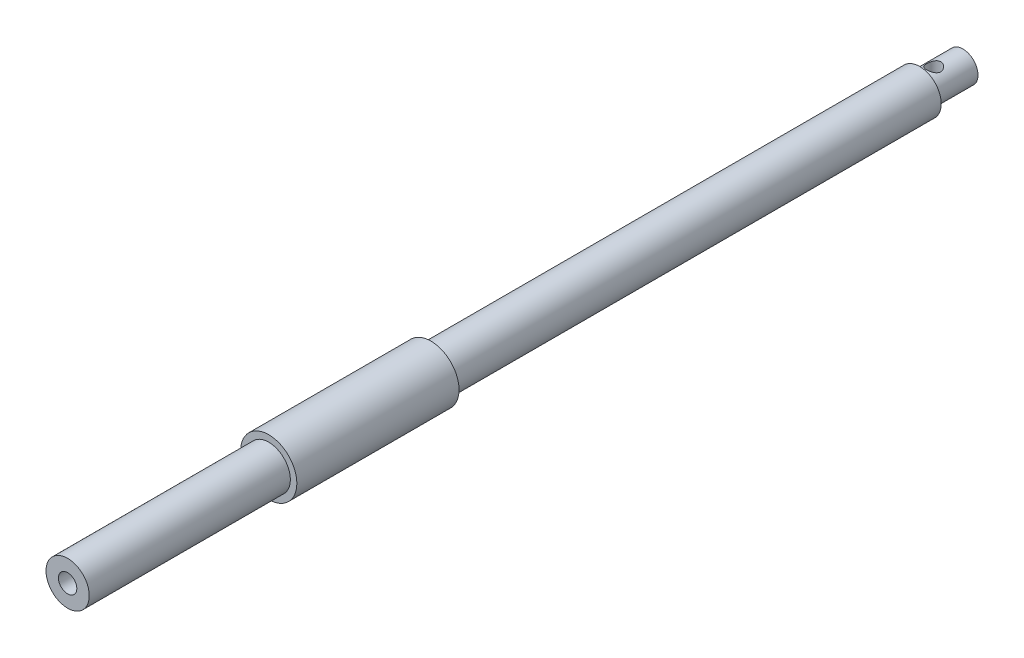
from build123d import *

# Parameters (mm, degrees)
SCHIZZO1_R                    = 7
ESTRUSIONE1_DEPTH             = 20
SCHIZZO2_R                    = 10
ESTRUSIONE2_DEPTH             = 226
SCHIZZO6_R                    = 13
ESTRUSIONE_ESTRUSIONE1_DEPTH  = 75
SCHIZZO7_R                    = 10
ESTRUSIONE_ESTRUSIONE2_DEPTH  = 93
FORO_FILETTATO_M10_1_D        = 8.5
FORO_FILETTATO_M10_1_DEPTH    = 27.5
FORO_FILETTATO_M10_1_TIP      = 2.553657631
TAGLIO_ESTRUSIONE1_DEPTH      = 10
TAGLIO_ESTRUSIONE1_DEPTH_BACK = 10
SCHIZZO10_R                   = 3.25


with BuildPart() as part:
    # Schizzo1 → Estrusione1 (new body)
    with BuildSketch(Plane.XY):
        Circle(SCHIZZO1_R)
    extrude(amount=ESTRUSIONE1_DEPTH)

    # Schizzo2 → Estrusione2 (add)
    with BuildSketch(Plane.XY.offset(20)):
        Circle(SCHIZZO2_R)
    extrude(amount=ESTRUSIONE2_DEPTH)

    # Schizzo6 → Estrusione-Estrusione1 (add)
    with BuildSketch(Plane.XY.offset(246)):
        Circle(SCHIZZO6_R)
    extrude(amount=ESTRUSIONE_ESTRUSIONE1_DEPTH)

    # Schizzo7 → Estrusione-Estrusione2 (add)
    with BuildSketch(Plane.XY.offset(321)):
        Circle(SCHIZZO7_R)
    extrude(amount=ESTRUSIONE_ESTRUSIONE2_DEPTH)

    # Foro filettato M10-1
    with Locations(Plane.XY.offset(414)):
        with Locations((0, 0)):
            Hole(FORO_FILETTATO_M10_1_D / 2, depth=FORO_FILETTATO_M10_1_DEPTH)
            with Locations((0, 0, -(FORO_FILETTATO_M10_1_DEPTH + FORO_FILETTATO_M10_1_TIP / 2))):  # 118° drill point
                Cone(0, FORO_FILETTATO_M10_1_D / 2, FORO_FILETTATO_M10_1_TIP, mode=Mode.SUBTRACT)

    # Schizzo10 → Taglio-Estrusione1 (cut, two sides: drawn at the far end of the back side and taken through both)
    with BuildSketch(Plane(origin=(0, 0, 0), x_dir=(1, 0, 0), z_dir=(0, 1, 0)).offset(-TAGLIO_ESTRUSIONE1_DEPTH_BACK)):
        with Locations((0, -13.5)):
            Circle(SCHIZZO10_R)
    extrude(amount=TAGLIO_ESTRUSIONE1_DEPTH + TAGLIO_ESTRUSIONE1_DEPTH_BACK, mode=Mode.SUBTRACT)


solid = part.part
